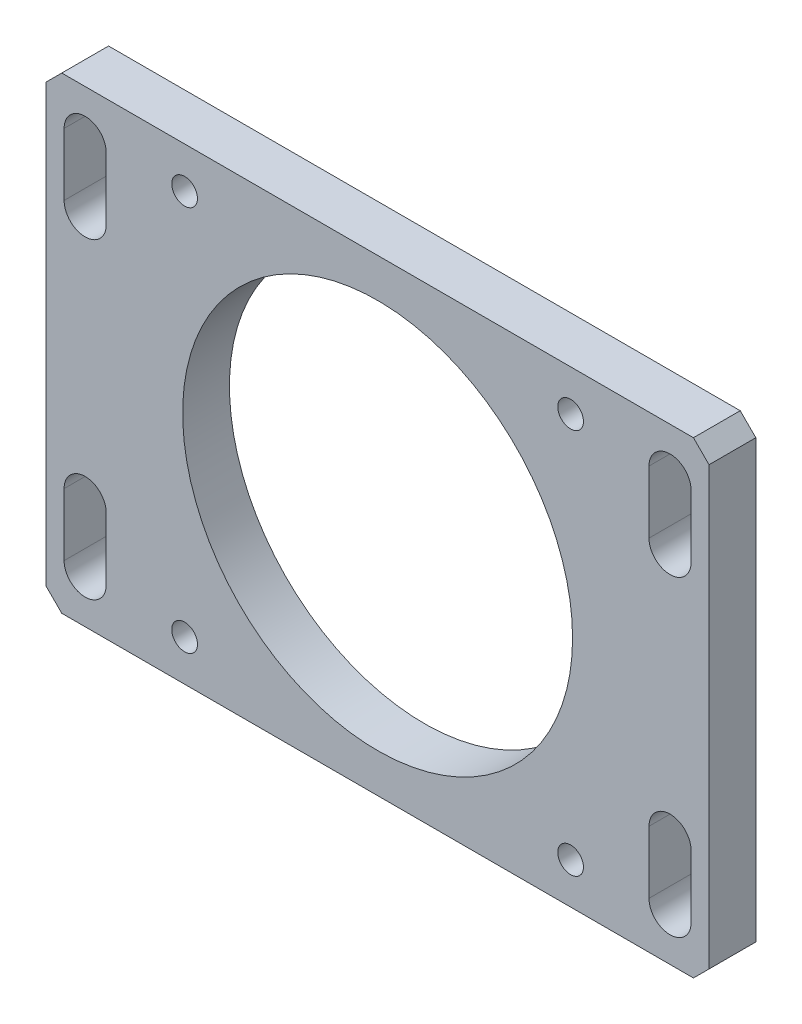
from build123d import *

# Parameters (mm, degrees)
SKETCH_1_W               = 85
SKETCH_1_H               = 60
SKETCH_1_R               = 25
EXTRUDE_1_DEPTH          = 6
PATTERN_CIRCULAR_1_COUNT = 4
CUT_EXTRUDE_1_DEPTH      = 6
CHAMFER_1_SIZE           = 2


with BuildPart() as part:
    # 草图1 → 凸台-拉伸1 (new body)
    with BuildSketch(Plane.XY):
        Rectangle(SKETCH_1_W, SKETCH_1_H)
        Circle(SKETCH_1_R, mode=Mode.SUBTRACT)
    extrude(amount=EXTRUDE_1_DEPTH)

    # 草图2 → M4 螺纹孔1 (revolve, cut)
    with BuildSketch(Plane(origin=(24.748737342, 24.748737342, 6), x_dir=(0, -1, 0), z_dir=(1, 0, 0))):
        Polygon((0, 0), (0, 12.491420021), (1.65, 11.5), (1.65, 0), align=None)
    hole_wizard_m4_1 = revolve(axis=Axis((24.748737342, 24.748737342, 12.35), (0, 0, -1)), mode=Mode.SUBTRACT)

    # 阵列(圆周)1: M4 螺纹孔1 ×4 about axis
    pattern_circular_1_axis = Axis((0, 0, 0), (0, 0, 1))
    for i in range(1, PATTERN_CIRCULAR_1_COUNT):
        add(hole_wizard_m4_1.rotate(pattern_circular_1_axis, i * 360 / PATTERN_CIRCULAR_1_COUNT), mode=Mode.SUBTRACT)

    # 草图4 → 切除-拉伸1 (cut)
    with BuildSketch(Plane.XY.offset(6)):
        with BuildLine():
            Line((40.2, 24), (40.2, 16))
            ThreePointArc((40.2, 16), (37.5, 13.3), (34.8, 16))
            Line((34.8, 16), (34.8, 24))
            ThreePointArc((34.8, 24), (37.5, 26.7), (40.2, 24))
        make_face()
        with BuildLine():
            Line((40.2, -24), (40.2, -16))
            ThreePointArc((40.2, -16), (37.5, -13.3), (34.8, -16))
            Line((34.8, -16), (34.8, -24))
            ThreePointArc((34.8, -24), (37.5, -26.7), (40.2, -24))
        make_face()
        with BuildLine():
            Line((-40.2, 24), (-40.2, 16))
            ThreePointArc((-40.2, 16), (-37.5, 13.3), (-34.8, 16))
            Line((-34.8, 16), (-34.8, 24))
            ThreePointArc((-34.8, 24), (-37.5, 26.7), (-40.2, 24))
        make_face()
        with BuildLine():
            Line((-40.2, -24), (-40.2, -16))
            ThreePointArc((-40.2, -16), (-37.5, -13.3), (-34.8, -16))
            Line((-34.8, -16), (-34.8, -24))
            ThreePointArc((-34.8, -24), (-37.5, -26.7), (-40.2, -24))
        make_face()
    extrude(amount=-CUT_EXTRUDE_1_DEPTH, mode=Mode.SUBTRACT)

    # 倒角1
    chamfer_1_edges = [part.edges().sort_by_distance(p)[0] for p in [
        (42.5, -30, 3),
        (-42.5, -30, 3),
        (-42.5, 30, 3),
        (42.5, 30, 3),
    ]]
    chamfer(chamfer_1_edges, length=CHAMFER_1_SIZE)


solid = part.part
